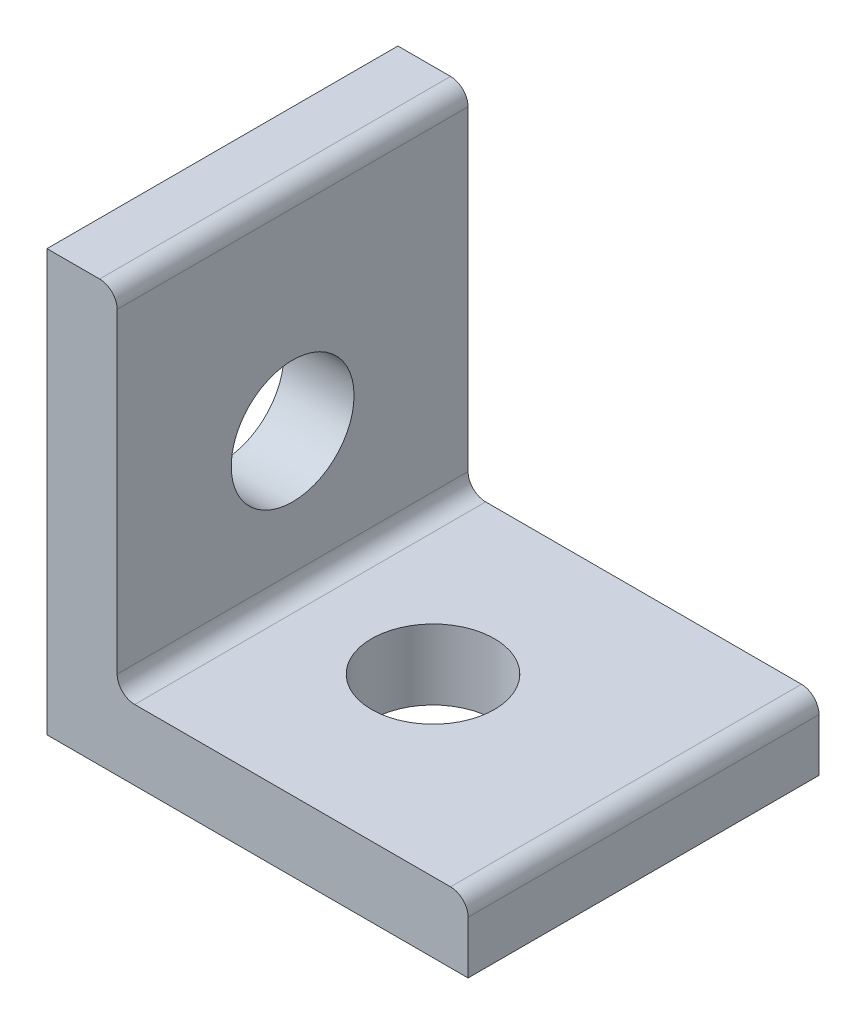
from build123d import *

# Parameters (mm, degrees)
BOSS_EXTRUDE1_START = -5
BOSS_EXTRUDE1_DEPTH = 10
SKETCH5_R           = 1.75
CUT_EXTRUDE1_DEPTH  = 10.848857802
SKETCH6_R           = 1.75
CUT_EXTRUDE2_DEPTH  = 10.848857802


with BuildPart() as part:
    # Sketch4 → Boss-Extrude1 (new body)
    with BuildSketch(Plane.XY.offset(BOSS_EXTRUDE1_START)):
        with BuildLine():
            Line((-6, 6), (-6, -6))
            Line((-6, -6), (6, -6))
            Line((6, -6), (6, -4.5))
            ThreePointArc((6, -4.5), (5.853553391, -4.146446609), (5.5, -4))
            Line((5.5, -4), (-3.5, -4))
            ThreePointArc((-3.5, -4), (-3.853553391, -3.853553391), (-4, -3.5))
            Line((-4, -3.5), (-4, 5.5))
            ThreePointArc((-4, 5.5), (-4.146446609, 5.853553391), (-4.5, 6))
            Line((-4.5, 6), (-6, 6))
        make_face()
    extrude(amount=BOSS_EXTRUDE1_DEPTH)

    # Sketch5 → Cut-Extrude1 (cut, through all)
    with BuildSketch(Plane(origin=(0, 0, 0), x_dir=(0, 0, -1), z_dir=(1, 0, 0))):
        Circle(SKETCH5_R)
    extrude(amount=-CUT_EXTRUDE1_DEPTH, mode=Mode.SUBTRACT)

    # Sketch6 → Cut-Extrude2 (cut, through all)
    with BuildSketch(Plane(origin=(0, 0, 0), x_dir=(1, 0, 0), z_dir=(0, 1, 0))):
        with Locations(Location((0, 0, 0), (0, 0, 270))):
            Circle(SKETCH6_R)
    extrude(amount=-CUT_EXTRUDE2_DEPTH, mode=Mode.SUBTRACT)


solid = part.part
